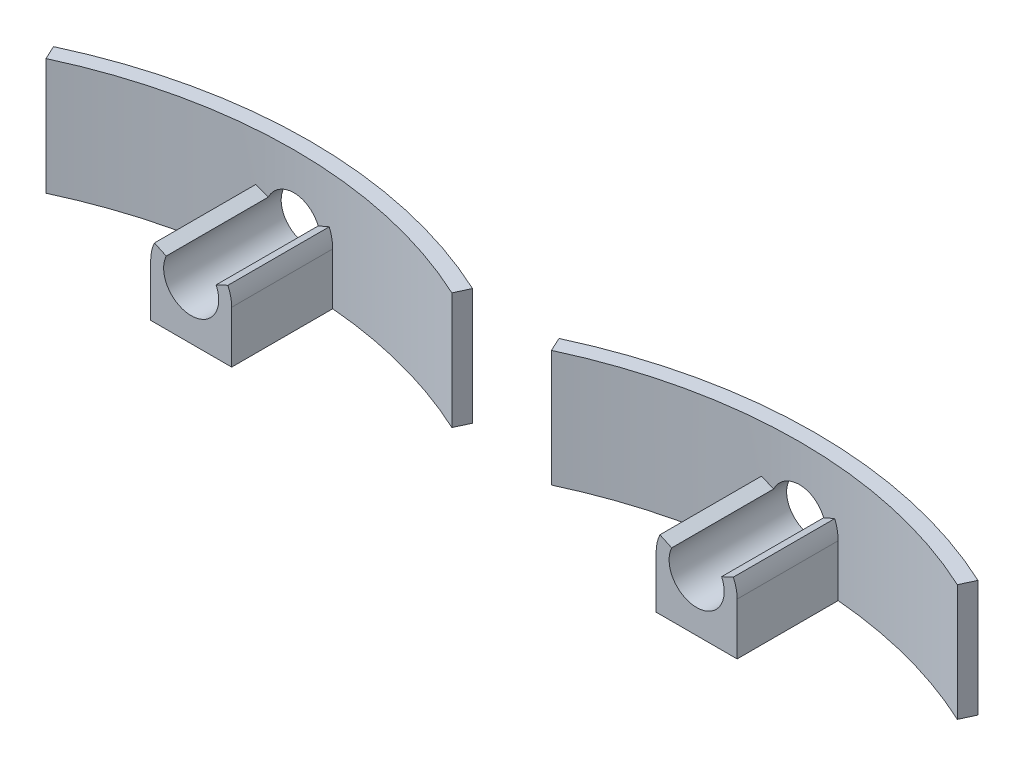
from build123d import *

# Parameters (mm, degrees)
BOSS_EXTRUDE1_DEPTH = 18
BOSS_EXTRUDE2_DEPTH = 18
SKETCH3_R           = 4.25
CUT_EXTRUDE1_DEPTH  = 39.451528899
LPATTERN1_COUNT     = 2
LPATTERN1_PITCH     = 78


with BuildPart() as part:
    # Sketch1 → Boss-Extrude1 (new body)
    with BuildSketch(Plane.XY):
        with BuildLine():
            Line((-5.664423669, 2.641364136), (-3.851808095, 1.796127612))
            ThreePointArc((-3.851808095, 1.796127612), (0, -4.25), (3.851808095, 1.796127612))
            Line((3.851808095, 1.796127612), (5.664423669, 2.641364136))
            ThreePointArc((5.664423669, 2.641364136), (6.101850044, 1.352747587), (6.25, 0))
            Line((6.25, 0), (6.25, -8))
            Line((6.25, -8), (-6.25, -8))
            Line((-6.25, -8), (-6.25, 0))
            ThreePointArc((-6.25, 0), (-6.101850044, 1.352747587), (-5.664423669, 2.641364136))
        make_face()
    extrude(amount=BOSS_EXTRUDE1_DEPTH)

    # Sketch2 → Boss-Extrude2 (add)
    with BuildSketch(Plane.XZ.offset(8)):
        with BuildLine():
            ThreePointArc((6.25, 0), (19.597264743, 2.297002396), (32.330297023, 6.911716371))
            Line((32.330297023, 6.911716371), (31.316013195, 9.08685506))
            ThreePointArc((31.316013195, 9.08685506), (19.077527897, 4.642181597), (6.25, 2.408312163))
            Line((6.25, 2.408312163), (6.25, 0))
        make_face()
        with BuildLine():
            Line((0, 0), (6.25, 0))
            Line((6.25, 0), (6.25, 2.408312163))
            ThreePointArc((6.25, 2.408312163), (3.127787655, 2.21030403), (0, 2.144262079))
            Line((0, 2.144262079), (0, 0))
        make_face()
        with BuildLine():
            ThreePointArc((0, -0.255737921), (3.127614981, -0.191776702), (6.25, 0))
            Line((6.25, 0), (0, 0))
            Line((0, 0), (0, -0.255737921))
        make_face()
        with BuildLine():
            ThreePointArc((-6.25, 0), (-3.127614981, -0.191776702), (0, -0.255737921))
            Line((0, -0.255737921), (0, 0))
            Line((0, 0), (-6.25, 0))
        make_face()
        with BuildLine():
            Line((-6.25, 0), (0, 0))
            Line((0, 0), (0, 2.144262079))
            ThreePointArc((0, 2.144262079), (-3.127787655, 2.21030403), (-6.25, 2.408312163))
            Line((-6.25, 2.408312163), (-6.25, 0))
        make_face()
        with BuildLine():
            ThreePointArc((-32.330297023, 6.911716371), (-19.597264743, 2.297002396), (-6.25, 0))
            Line((-6.25, 0), (-6.25, 2.408312163))
            ThreePointArc((-6.25, 2.408312163), (-19.077527897, 4.642181597), (-31.316013195, 9.08685506))
            Line((-31.316013195, 9.08685506), (-32.330297023, 6.911716371))
        make_face()
    extrude(amount=-BOSS_EXTRUDE2_DEPTH)

    # Sketch3 → Cut-Extrude1 (cut, through all)
    with BuildSketch(Plane.XY.offset(18)):
        with Locations(Location((0, 0, 0), (0, 0, 155))):
            Circle(SKETCH3_R)
    extrude(amount=-CUT_EXTRUDE1_DEPTH, mode=Mode.SUBTRACT)


with BuildPart() as lpattern1_1:
    # LPattern1: pattern copy
    add(part.part.moved(Location(Vector(-1, 0, 0) * (1 * LPATTERN1_PITCH))))


solid = Compound([part.part, lpattern1_1.part])
